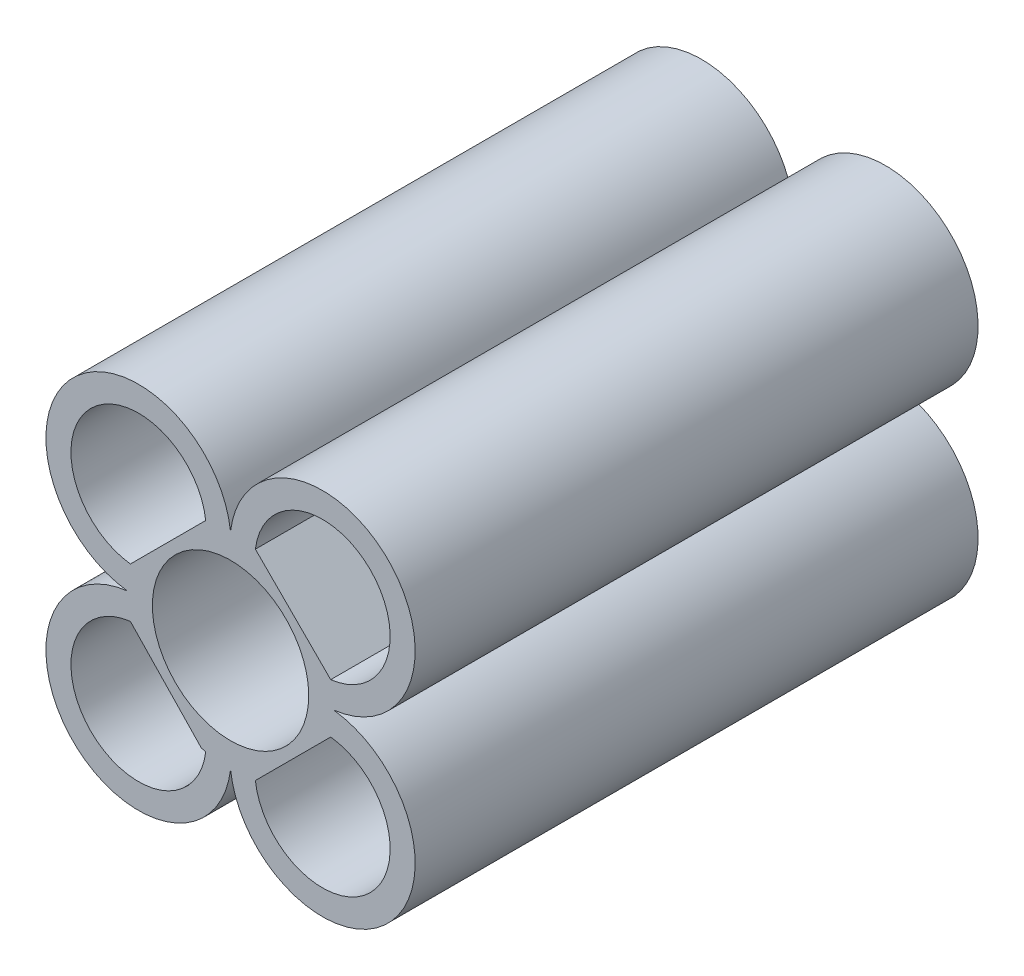
from build123d import *

# Parameters (mm, degrees)
SKETCH1_R           = 62.5
BOSS_EXTRUDE1_DEPTH = 450
SCALE1_SCALE        = 2


with BuildPart() as part:
    # Sketch1 → Boss-Extrude1 (new body)
    with BuildSketch(Plane.XY):
        with BuildLine():
            ThreePointArc((0, 82.5), (-125.896146437, 125.896146437), (-82.5, 0))
            ThreePointArc((-82.5, 0), (-125.896146437, -125.896146437), (0, -82.5))
            ThreePointArc((0, -82.5), (125.896146437, -125.896146437), (82.5, 0))
            ThreePointArc((82.5, 0), (125.896146437, 125.896146437), (0, 82.5))
        make_face()
        with BuildLine():
            ThreePointArc((-20.204468067, -82.5), (-112.61028354, -110.878115832), (-80.075757576, -19.85253255))
            Line((-80.075757576, -19.85253255), (-23.459201006, -79.094348016))
            ThreePointArc((-23.459201006, -79.094348016), (-21.661425556, -79.605481237), (-19.85253255, -80.075757576))
            ThreePointArc((-19.85253255, -80.075757576), (-20.014769218, -81.289872177), (-20.204468067, -82.5))
        make_face(mode=Mode.SUBTRACT)
        with BuildLine():
            ThreePointArc((80.075757576, -19.85253255), (111.754010814, -111.754010814), (19.85253255, -80.075757576))
            Line((19.85253255, -80.075757576), (80.075757576, -19.85253255))
        make_face(mode=Mode.SUBTRACT)
        Circle(SKETCH1_R, mode=Mode.SUBTRACT)
        with BuildLine():
            ThreePointArc((-80.075757576, 19.85253255), (-111.754010814, 111.754010814), (-19.85253255, 80.075757576))
            Line((-19.85253255, 80.075757576), (-80.075757576, 19.85253255))
        make_face(mode=Mode.SUBTRACT)
        with BuildLine():
            ThreePointArc((19.85253255, 80.075757576), (111.754010814, 111.754010814), (80.075757576, 19.85253255))
            Line((80.075757576, 19.85253255), (19.85253255, 80.075757576))
        make_face(mode=Mode.SUBTRACT)
    extrude(amount=BOSS_EXTRUDE1_DEPTH)


with BuildPart() as part_1:
    # Scale1: scaled about (-0.110996519, -0.161131332, 225)
    add(part.part.scale(SCALE1_SCALE).moved(Location((0.110996519, 0.161131332, -225))))


solid = part_1.part
